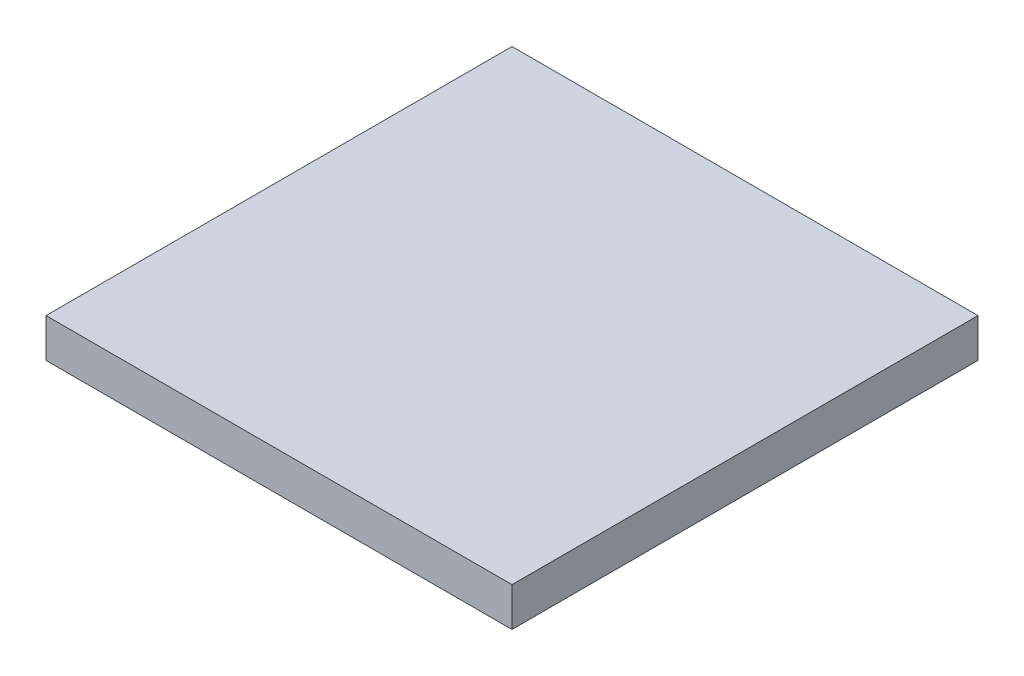
from build123d import *

# Parameters (mm, degrees)
SKETCH1_W           = 6
SKETCH1_H           = 6
BOSS_EXTRUDE1_DEPTH = 0.5


with BuildPart() as part:
    # Sketch1 → Boss-Extrude1 (new body)
    with BuildSketch(Plane(origin=(0, 0, 0), x_dir=(1, 0, 0), z_dir=(0, 1, 0))):
        Rectangle(SKETCH1_W, SKETCH1_H)
    extrude(amount=BOSS_EXTRUDE1_DEPTH)


solid = part.part
